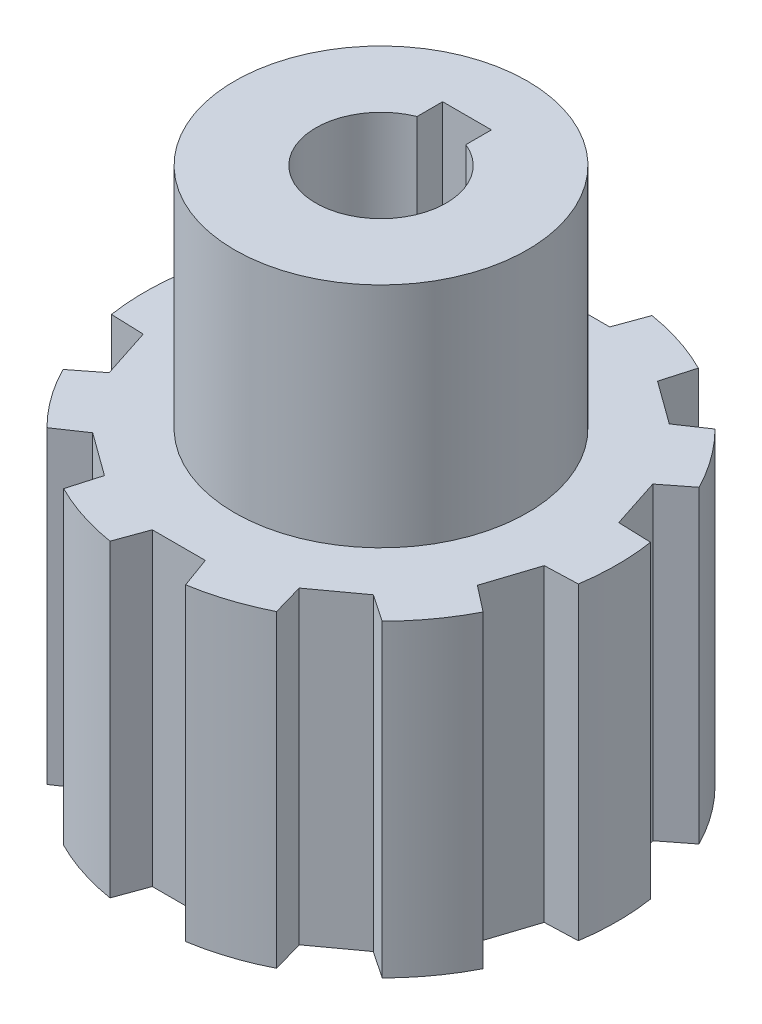
from build123d import *

# Parameters (mm, degrees)
BOSS_EXTRUDE1_DEPTH       = 19
SKETCH3_R                 = 4.01
CUT_EXTRUDE1_DEPTH        = 29.952983186
SKETCH4_W                 = 3
SKETCH4_H                 = 4.35070692
CUT_EXTRUDE2_DEPTH        = 29.952983186
BOSS_EXTRUDE2_START       = 14
SKETCH5_R                 = 9
BOSS_EXTRUDE2_DEPTH       = 14
M3X0_5_TAPPED_HOLE1_D     = 2.5
M3X0_5_TAPPED_HOLE1_DEPTH = 10
M3X0_5_TAPPED_HOLE1_TIP   = 0.751075774


with BuildPart() as part:
    # Sketch2 → Boss-Extrude1 (new body)
    with BuildSketch(Plane(origin=(0, 0, 0), x_dir=(1, 0, 0), z_dir=(0, 1, 0))):
        with BuildLine():
            Line((7.335535963, -10.343914335), (9.974123377, -8.426868365))
            Line((9.974123377, -8.426868365), (11.654796972, -9.560497019))
            ThreePointArc((11.654796972, -9.560497019), (13.098043776, -7.864477351), (14.265066544, -5.967769174))
            Line((14.265066544, -5.967769174), (12.667564922, -4.719664118))
            Line((12.667564922, -4.719664118), (13.675415632, -1.617818581))
            Line((13.675415632, -1.617818581), (15.701439337, -1.547068275))
            ThreePointArc((15.701439337, -1.547068275), (15.87215518, 0.673359646), (15.701439337, 2.893787567))
            Line((15.701439337, 2.893787567), (13.675415632, 2.964537874))
            Line((13.675415632, 2.964537874), (12.667564922, 6.066383411))
            Line((12.667564922, 6.066383411), (14.265066544, 7.314488466))
            ThreePointArc((14.265066544, 7.314488466), (13.098043776, 9.211196644), (11.654796972, 10.907216312))
            Line((11.654796972, 10.907216312), (9.974123377, 9.773587658))
            Line((9.974123377, 9.773587658), (7.335535963, 11.690633627))
            Line((7.335535963, 11.690633627), (7.894324179, 13.639359722))
            ThreePointArc((7.894324179, 13.639359722), (5.835325832, 14.487870099), (3.670819293, 15.011659646))
            Line((3.670819293, 15.011659646), (2.977455996, 13.106659646))
            Line((2.977455996, 13.106659646), (-0.284017411, 13.106659646))
            Line((-0.284017411, 13.106659646), (-0.977380707, 15.011659646))
            ThreePointArc((-0.977380707, 15.011659646), (-3.141887247, 14.487870099), (-5.200885594, 13.639359722))
            Line((-5.200885594, 13.639359722), (-4.642097378, 11.690633627))
            Line((-4.642097378, 11.690633627), (-7.280684791, 9.773587658))
            Line((-7.280684791, 9.773587658), (-8.961358387, 10.907216312))
            ThreePointArc((-8.961358387, 10.907216312), (-10.40460519, 9.211196644), (-11.571627958, 7.314488466))
            Line((-11.571627958, 7.314488466), (-9.974126336, 6.066383411))
            Line((-9.974126336, 6.066383411), (-10.981977046, 2.964537874))
            Line((-10.981977046, 2.964537874), (-13.008000751, 2.893787567))
            ThreePointArc((-13.008000751, 2.893787567), (-13.178716594, 0.673359646), (-13.008000751, -1.547068275))
            Line((-13.008000751, -1.547068275), (-10.981977046, -1.617818581))
            Line((-10.981977046, -1.617818581), (-9.974126336, -4.719664118))
            Line((-9.974126336, -4.719664118), (-11.571627958, -5.967769174))
            ThreePointArc((-11.571627958, -5.967769174), (-10.40460519, -7.864477351), (-8.961358387, -9.560497019))
            Line((-8.961358387, -9.560497019), (-7.280684791, -8.426868365))
            Line((-7.280684791, -8.426868365), (-4.642097378, -10.343914335))
            Line((-4.642097378, -10.343914335), (-5.200885594, -12.292640429))
            ThreePointArc((-5.200885594, -12.292640429), (-3.141887247, -13.141150806), (-0.977380707, -13.664940354))
            Line((-0.977380707, -13.664940354), (-0.284017411, -11.759940354))
            Line((-0.284017411, -11.759940354), (2.977455996, -11.759940354))
            Line((2.977455996, -11.759940354), (3.670819293, -13.664940354))
            ThreePointArc((3.670819293, -13.664940354), (5.835325832, -13.141150806), (7.894324179, -12.292640429))
            Line((7.894324179, -12.292640429), (7.335535963, -10.343914335))
        make_face()
    extrude(amount=BOSS_EXTRUDE1_DEPTH)

    # Sketch3 → Cut-Extrude1 (cut, through all)
    with BuildSketch(Plane(origin=(0, 19, 0), x_dir=(1, 0, 0), z_dir=(0, 1, 0))):
        with Locations(Location((1.346719293, 0.673359646, 0), (0, 0, 270))):
            Circle(SKETCH3_R)
    extrude(amount=-CUT_EXTRUDE1_DEPTH, mode=Mode.SUBTRACT)

    # Sketch4 → Cut-Extrude2 (cut, through all)
    with BuildSketch(Plane(origin=(0, 19, 0), x_dir=(1, 0, 0), z_dir=(0, 1, 0))):
        with Locations((1.346719293, 3.788006186)):
            Rectangle(SKETCH4_W, SKETCH4_H)
    extrude(amount=-CUT_EXTRUDE2_DEPTH, mode=Mode.SUBTRACT)

    # Sketch5 → Boss-Extrude2 (add)
    with BuildSketch(Plane(origin=(0, 19, 0), x_dir=(1, 0, 0), z_dir=(0, 1, 0)).offset(BOSS_EXTRUDE2_START)):
        with Locations(Location((1.346719293, 0.673359646, 0), (0, 0, 270))):
            Circle(SKETCH5_R)
        with BuildLine():
            Line((2.846719293, 4.392243888), (2.846719293, 5.963359646))
            Line((2.846719293, 5.963359646), (-0.153280707, 5.963359646))
            Line((-0.153280707, 5.963359646), (-0.153280707, 4.392243888))
            ThreePointArc((-0.153280707, 4.392243888), (1.346719293, -3.336640354), (2.846719293, 4.392243888))
        make_face(mode=Mode.SUBTRACT)
    extrude(amount=-BOSS_EXTRUDE2_DEPTH)

    # M3x0.5 Tapped Hole1
    with Locations(Plane(origin=(1.346719293, 16.7, -13.106659646), x_dir=(-1, 0, 0), z_dir=(0, 0, -1))):
        with Locations((0, 0)):
            Hole(M3X0_5_TAPPED_HOLE1_D / 2, depth=M3X0_5_TAPPED_HOLE1_DEPTH)
            with Locations((0, 0, -(M3X0_5_TAPPED_HOLE1_DEPTH + M3X0_5_TAPPED_HOLE1_TIP / 2))):  # 118° drill point
                Cone(0, M3X0_5_TAPPED_HOLE1_D / 2, M3X0_5_TAPPED_HOLE1_TIP, mode=Mode.SUBTRACT)


solid = part.part
